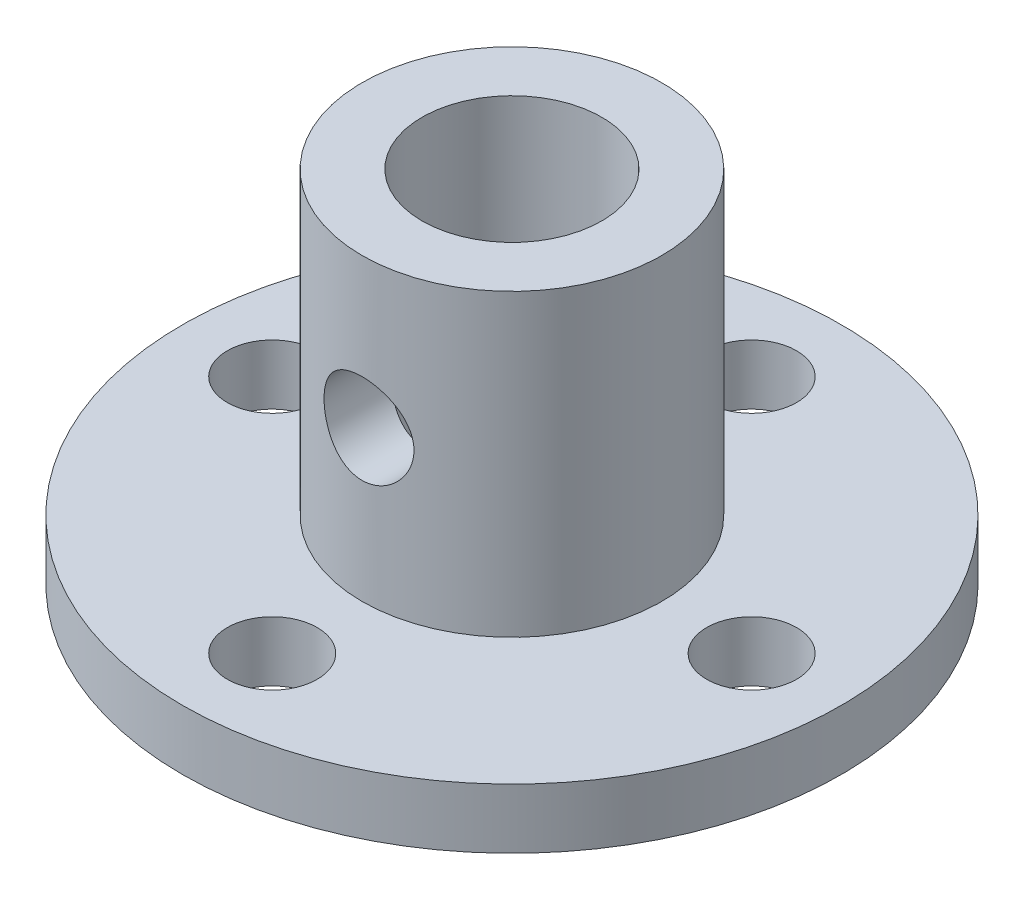
from build123d import *

# Parameters (mm, degrees)
SKETCH_1_R               = 11
EXTRUDE_1_DEPTH          = 2
SKETCH_2_R               = 1.5
CUT_EXTRUDE_1_DEPTH      = 2
SKETCH_3_R               = 5
EXTRUDE_2_DEPTH          = 10
SKETCH_4_R               = 3
CUT_EXTRUDE_2_DEPTH      = 12
CUT_EXTRUDE_4_DEPTH      = 5
CUT_EXTRUDE_4_DEPTH_BACK = 5
SKETCH_5_R               = 1.5


with BuildPart() as part:
    # 草图1 → 凸台-拉伸1 (new body)
    with BuildSketch(Plane(origin=(0, 0, 0), x_dir=(1, 0, 0), z_dir=(0, 1, 0))):
        Circle(SKETCH_1_R)
    extrude(amount=EXTRUDE_1_DEPTH)

    # 草图2 → 切除-拉伸1 (cut)
    with BuildSketch(Plane.XZ):
        with Locations((0, -8)):
            Circle(SKETCH_2_R)
        with Locations((8, 0)):
            Circle(SKETCH_2_R)
        with Locations((-8, 0)):
            Circle(SKETCH_2_R)
        with Locations((0, 8)):
            Circle(SKETCH_2_R)
    extrude(amount=-CUT_EXTRUDE_1_DEPTH, mode=Mode.SUBTRACT)

    # 草图3 → 凸台-拉伸2 (add)
    with BuildSketch(Plane(origin=(0, 2, 0), x_dir=(1, 0, 0), z_dir=(0, 1, 0))):
        Circle(SKETCH_3_R)
    extrude(amount=EXTRUDE_2_DEPTH)

    # 草图4 → 切除-拉伸2 (cut)
    with BuildSketch(Plane(origin=(0, 12, 0), x_dir=(1, 0, 0), z_dir=(0, 1, 0))):
        Circle(SKETCH_4_R)
    extrude(amount=-CUT_EXTRUDE_2_DEPTH, mode=Mode.SUBTRACT)

    # 草图5 → 切除-拉伸4 (cut, two sides: drawn at the far end of the back side and taken through both)
    with BuildSketch(Plane.XY.offset(-CUT_EXTRUDE_4_DEPTH_BACK)):
        with Locations((0, 7)):
            Circle(SKETCH_5_R)
    extrude(amount=CUT_EXTRUDE_4_DEPTH + CUT_EXTRUDE_4_DEPTH_BACK, mode=Mode.SUBTRACT)


solid = part.part
